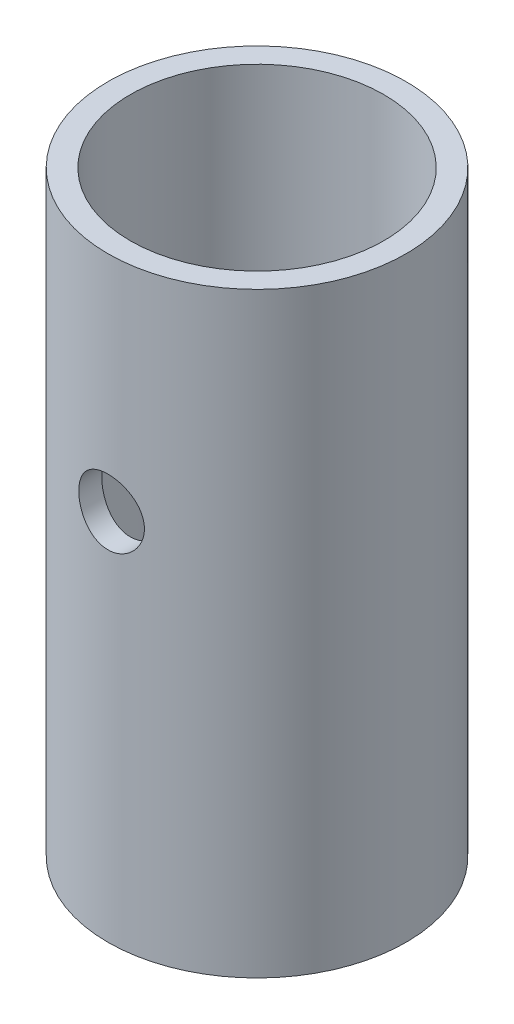
from build123d import *

# Parameters (mm, degrees)
SKETCH1_R               = 5
BOSS_EXTRUDE1_DEPTH     = 20
SKETCH2_R               = 4.25
CUT_EXTRUDE1_DEPTH      = 17.5
SKETCH3_R               = 1.25
CUT_EXTRUDE2_DEPTH      = 2.5
CUT_EXTRUDE3_DEPTH      = 10
CUT_EXTRUDE3_DEPTH_BACK = 10
SKETCH4_R               = 1.1


with BuildPart() as part:
    # Sketch1 → Boss-Extrude1 (new body)
    with BuildSketch(Plane(origin=(0, 0, 0), x_dir=(1, 0, 0), z_dir=(0, 1, 0))):
        Circle(SKETCH1_R)
    extrude(amount=BOSS_EXTRUDE1_DEPTH)

    # Sketch2 → Cut-Extrude1 (cut)
    with BuildSketch(Plane(origin=(0, 20, 0), x_dir=(1, 0, 0), z_dir=(0, 1, 0))):
        Circle(SKETCH2_R)
    extrude(amount=-CUT_EXTRUDE1_DEPTH, mode=Mode.SUBTRACT)

    # Sketch3 → Cut-Extrude2 (cut)
    with BuildSketch(Plane.XZ):
        Circle(SKETCH3_R)
    extrude(amount=-CUT_EXTRUDE2_DEPTH, mode=Mode.SUBTRACT)

    # Sketch4 → Cut-Extrude3 (cut, two sides: drawn at the far end of the back side and taken through both)
    with BuildSketch(Plane.XY.offset(-CUT_EXTRUDE3_DEPTH_BACK)):
        with Locations((0, 12.5)):
            Circle(SKETCH4_R)
    extrude(amount=CUT_EXTRUDE3_DEPTH + CUT_EXTRUDE3_DEPTH_BACK, mode=Mode.SUBTRACT)


solid = part.part
